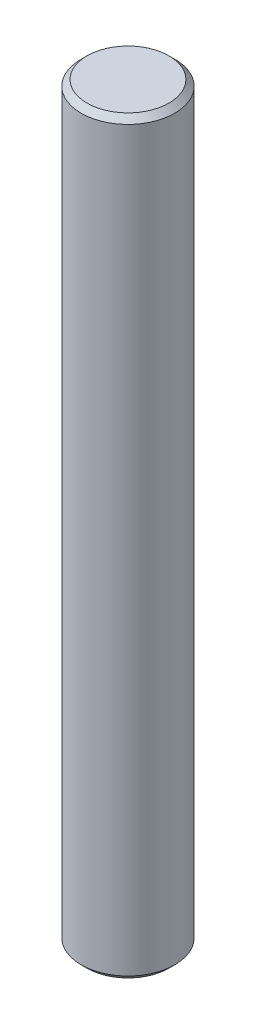
from build123d import *

# Parameters (mm, degrees)
SKETCH1_R           = 2
BOSS_EXTRUDE1_DEPTH = 16
CHAMFER1_SIZE       = 0.25


with BuildPart() as part:
    # Sketch1 → Boss-Extrude1 (new, symmetric)
    with BuildSketch(Plane(origin=(0, 0, 0), x_dir=(1, 0, 0), z_dir=(0, 1, 0))):
        with Locations(Location((0, 0, 0), (0, 0, 270))):
            Circle(SKETCH1_R)
    extrude(amount=BOSS_EXTRUDE1_DEPTH, both=True)

    # Chamfer1
    chamfer1_edges = [part.edges().sort_by_distance(p)[0] for p in [
        (0, -16, -2),
        (0, 16, -2),
    ]]
    chamfer(chamfer1_edges, length=CHAMFER1_SIZE)


solid = part.part
